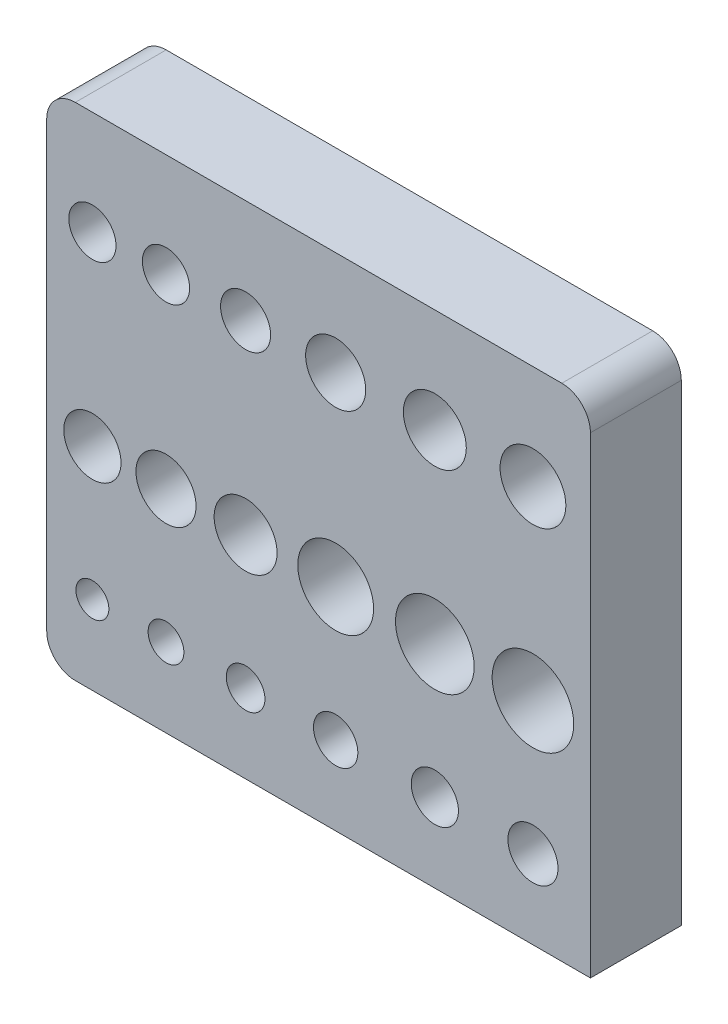
from build123d import *

# Parameters (mm, degrees)
SKETCH1_R           = 1.65
SKETCH1_R_2         = 2.2
SKETCH1_R_3         = 2.1
SKETCH1_R_4         = 2.75
SKETCH1_R_5         = 1.75
SKETCH1_R_6         = 2.3
SKETCH1_R_7         = 2.85
SKETCH1_R_8         = 2.65
SKETCH1_R_9         = 2
SKETCH1_R_10        = 1.25
SKETCH1_R_11        = 1.35
SKETCH1_R_12        = 1.55
SKETCH1_R_13        = 1.15
BOSS_EXTRUDE1_DEPTH = 6.35


with BuildPart() as part:
    # Sketch1 → Boss-Extrude1 (new body)
    with BuildSketch(Plane.XY):
        with BuildLine():
            Line((2, 0), (38, 0))
            Line((38, 0), (38, 33))
            ThreePointArc((38, 33), (37.414213562, 34.414213562), (36, 35))
            Line((36, 35), (2, 35))
            ThreePointArc((2, 35), (0.585786438, 34.414213562), (0, 33))
            Line((0, 33), (0, 2))
            ThreePointArc((0, 2), (0.585786438, 0.585786438), (2, 0))
        make_face()
        with Locations((8.336360719, 27.737428386)):
            Circle(SKETCH1_R, mode=Mode.SUBTRACT)
        with Locations((27.124645172, 27.737428386)):
            Circle(SKETCH1_R_2, mode=Mode.SUBTRACT)
        with Locations((8.336360719, 14.775034728)):
            Circle(SKETCH1_R_3, mode=Mode.SUBTRACT)
        with Locations((27.124645172, 14.775034728)):
            Circle(SKETCH1_R_4, mode=Mode.SUBTRACT)
        with Locations((13.899554089, 27.737428386)):
            Circle(SKETCH1_R_5, mode=Mode.SUBTRACT)
        with Locations((33.982726189, 27.737428386)):
            Circle(SKETCH1_R_6, mode=Mode.SUBTRACT)
        with Locations((20.195125811, 27.737428386)):
            Circle(SKETCH1_R_3, mode=Mode.SUBTRACT)
        with Locations((3.192799956, 27.737428386)):
            Circle(SKETCH1_R, mode=Mode.SUBTRACT)
        with Locations((33.982726189, 14.775034728)):
            Circle(SKETCH1_R_7, mode=Mode.SUBTRACT)
        with Locations((20.195125811, 14.775034728)):
            Circle(SKETCH1_R_8, mode=Mode.SUBTRACT)
        with Locations((3.192799956, 14.775034728)):
            Circle(SKETCH1_R_9, mode=Mode.SUBTRACT)
        with Locations((13.899554089, 14.775034728)):
            Circle(SKETCH1_R_2, mode=Mode.SUBTRACT)
        with Locations((8.336360719, 5.504307148)):
            Circle(SKETCH1_R_10, mode=Mode.SUBTRACT)
        with Locations((27.124645172, 5.504307148)):
            Circle(SKETCH1_R, mode=Mode.SUBTRACT)
        with Locations((13.899554089, 5.504307148)):
            Circle(SKETCH1_R_11, mode=Mode.SUBTRACT)
        with Locations((33.982726189, 5.504307148)):
            Circle(SKETCH1_R_5, mode=Mode.SUBTRACT)
        with Locations((20.195125811, 5.504307148)):
            Circle(SKETCH1_R_12, mode=Mode.SUBTRACT)
        with Locations((3.192799956, 5.504307148)):
            Circle(SKETCH1_R_13, mode=Mode.SUBTRACT)
    extrude(amount=BOSS_EXTRUDE1_DEPTH)


solid = part.part
